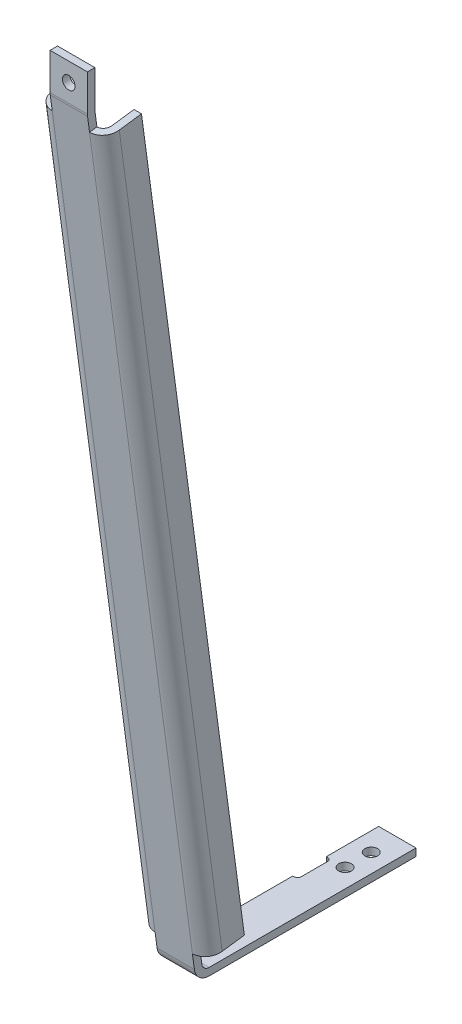
from build123d import *

# Parameters (mm, degrees)
FORMED_WEB_DEPTH           = 10
EDGE_STIFFENING_LIPS_DEPTH = 206.123068282
WALL_MOUNT_HOLE_SKETCH_R   = 1.7
WALL_MOUNT_HOLES_DEPTH     = 2.4
COVER_MOUNT_HOLE_SKETCH_R  = 1.7
COVER_MOUNT_HOLE_DEPTH     = 2.4
FRAME_MOUNT_RELIEF_DEPTH   = 2.4


with BuildPart() as part:
    # Formed Web Section Sketch → Formed Web (new body)
    with BuildSketch(Plane(origin=(-30, 0, 0), x_dir=(0, 0, -1), z_dir=(1, 0, 0))):
        with BuildLine():
            Line((-22, 64), (-77.377483747, 64))
            ThreePointArc((-77.377483747, 64), (-80.010089753, 64.988457933), (-81.341585612, 67.46530719))
            Line((-81.341585612, 67.46530719), (-109.964101865, 279.66672079))
            ThreePointArc((-109.964101865, 279.66672079), (-109.991015376, 279.933465342), (-110, 280.2014136))
            Line((-110, 280.2014136), (-110, 290))
            Line((-110, 290), (-108, 290))
            Line((-108, 290), (-108, 280.2014136))
            ThreePointArc((-108, 280.2014136), (-107.995507688, 280.067439471), (-107.982050933, 279.934067195))
            Line((-107.982050933, 279.934067195), (-79.35953468, 67.732653595))
            ThreePointArc((-79.35953468, 67.732653595), (-78.69378675, 66.494228967), (-77.377483747, 66))
            Line((-77.377483747, 66), (-22, 66))
            Line((-22, 66), (-22, 64))
        make_face()
    extrude(amount=FORMED_WEB_DEPTH)

    # Edge Lip Sketch → Edge Stiffening Lips (add)
    with BuildSketch(Plane(origin=(0, 80.999511953, 10.925515566), x_dir=(-1, 0, 0), z_dir=(0, -0.9910254663478989, -0.1336732024376229))):
        with BuildLine():
            Line((34, -67.593279149), (34, -61.593279149))
            Line((34, -61.593279149), (32, -61.593279149))
            Line((32, -61.593279149), (32, -67.593279149))
            ThreePointArc((32, -67.593279149), (31.414213562, -69.007492712), (30, -69.593279149))
            Line((30, -69.593279149), (29.9, -69.593279149))
            Line((29.9, -69.593279149), (29.9, -71.593279149))
            Line((29.9, -71.593279149), (30, -71.593279149))
            ThreePointArc((30, -71.593279149), (32.828427125, -70.421706274), (34, -67.593279149))
        make_face()
        with BuildLine():
            Line((16, -67.593279149), (16, -61.593279149))
            Line((16, -61.593279149), (18, -61.593279149))
            Line((18, -61.593279149), (18, -67.593279149))
            ThreePointArc((18, -67.593279149), (18.585786438, -69.007492712), (20, -69.593279149))
            Line((20, -69.593279149), (20.1, -69.593279149))
            Line((20.1, -69.593279149), (20.1, -71.593279149))
            Line((20.1, -71.593279149), (20, -71.593279149))
            ThreePointArc((20, -71.593279149), (17.171572875, -70.421706274), (16, -67.593279149))
        make_face()
    extrude(amount=-EDGE_STIFFENING_LIPS_DEPTH)

    # Wall Mount Hole Sketch → Wall Mount Holes (cut)
    with BuildSketch(Plane(origin=(0, 63.8, 0), x_dir=(-1, 0, 0), z_dir=(0, -1, 0))):
        with Locations(Location((25, -29, 0), (0, 0, 90))):
            Circle(WALL_MOUNT_HOLE_SKETCH_R)
        with Locations(Location((25, -36, 0), (0, 0, 90))):
            Circle(WALL_MOUNT_HOLE_SKETCH_R)
    extrude(amount=-WALL_MOUNT_HOLES_DEPTH, mode=Mode.SUBTRACT)

    # Cover Mount Hole Sketch → Cover Mount Hole (cut)
    with BuildSketch(Plane.XY.offset(107.8)):
        with Locations(Location((-25, 285, 0), (0, 0, 90))):
            Circle(COVER_MOUNT_HOLE_SKETCH_R)
    extrude(amount=COVER_MOUNT_HOLE_DEPTH, mode=Mode.SUBTRACT)

    # Frame Mount Relief Sketch → Frame Mount Relief (cut)
    with BuildSketch(Plane(origin=(0, 63.8, 0), x_dir=(-1, 0, 0), z_dir=(0, -1, 0))):
        with BuildLine():
            Line((30, -36), (29.7, -36))
            ThreePointArc((29.7, -36), (28.992893219, -36.292893219), (28.7, -37))
            Line((28.7, -37), (28.7, -44))
            ThreePointArc((28.7, -44), (28.992893219, -44.707106781), (29.7, -45))
            Line((29.7, -45), (30, -45))
            ThreePointArc((30, -45), (30.707106781, -44.707106781), (31, -44))
            Line((31, -44), (31, -37))
            ThreePointArc((31, -37), (30.707106781, -36.292893219), (30, -36))
        make_face()
    extrude(amount=-FRAME_MOUNT_RELIEF_DEPTH, mode=Mode.SUBTRACT)


solid = part.part
